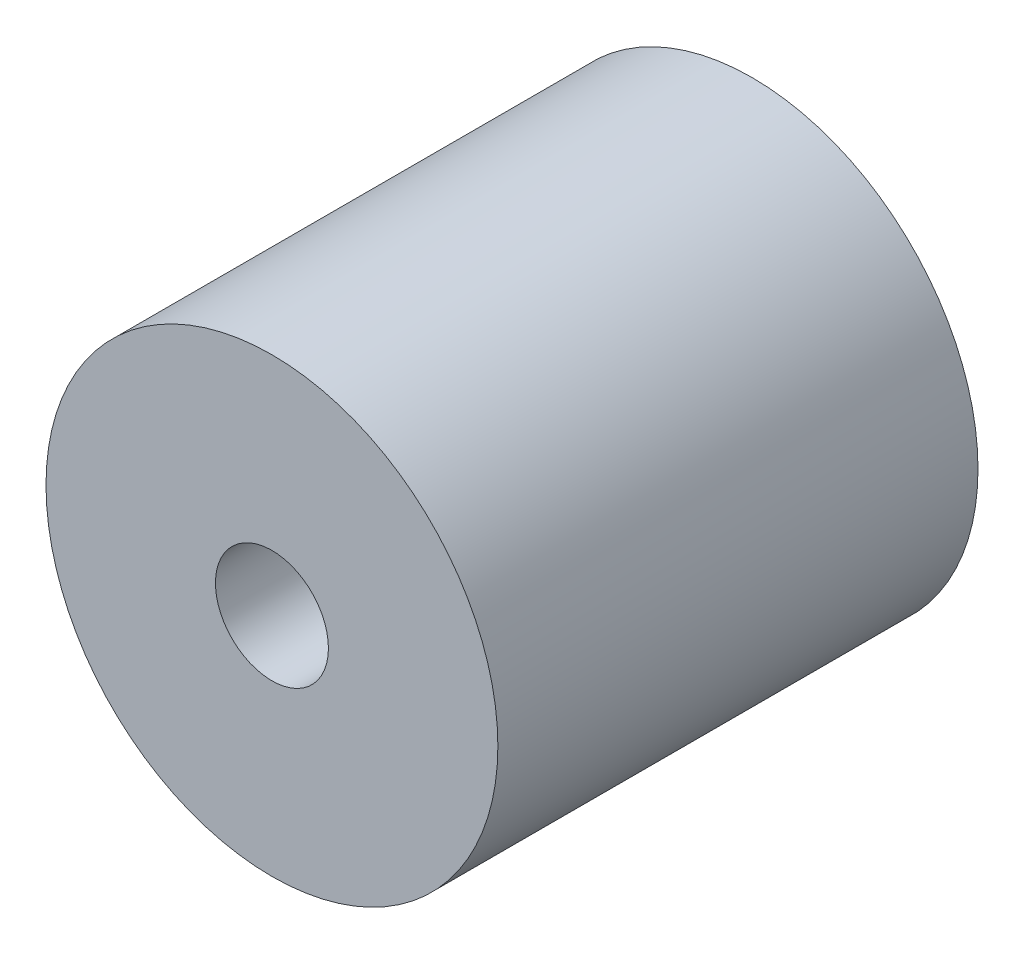
from build123d import *

# Parameters (mm, degrees)
CROQUIS1_R              = 4
SALIENTE_EXTRUIR1_DEPTH = 8.5
CROQUIS2_R              = 1
CORTAR_EXTRUIR1_DEPTH   = 11.210288928


with BuildPart() as part:
    # Croquis1 → Saliente-Extruir1 (new body)
    with BuildSketch(Plane.XY):
        Circle(CROQUIS1_R)
    extrude(amount=SALIENTE_EXTRUIR1_DEPTH)

    # Croquis2 → Cortar-Extruir1 (cut, through all)
    with BuildSketch(Plane.XY.offset(8.5)):
        Circle(CROQUIS2_R)
    extrude(amount=-CORTAR_EXTRUIR1_DEPTH, mode=Mode.SUBTRACT)


solid = part.part
